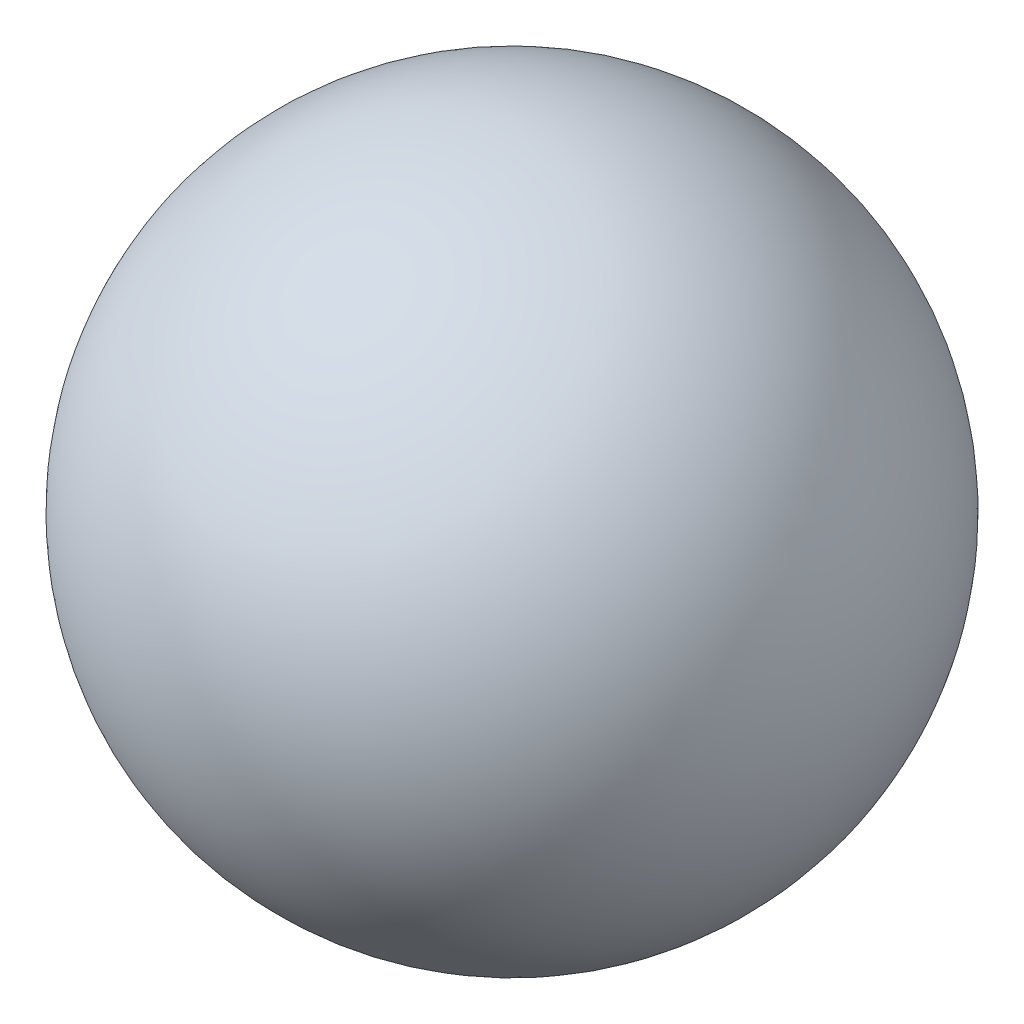
from build123d import *

# Parameters (mm, degrees)
SKETCH1_W           = 200
SKETCH1_H           = 200
BOSS_EXTRUDE1_DEPTH = 850
SKETCH2_R           = 3
CUT_EXTRUDE1_DEPTH  = 10


with BuildPart() as part:
    # Sketch1 → Boss-Extrude1 (new body)
    with BuildSketch(Plane(origin=(0, 0, 0), x_dir=(1, 0, 0), z_dir=(0, 1, 0))):
        with Locations((100, 100)):
            Rectangle(SKETCH1_W, SKETCH1_H)
    extrude(amount=BOSS_EXTRUDE1_DEPTH)

    # Sketch2 → Cut-Extrude1 (cut)
    with BuildSketch(Plane(origin=(0, 850, 0), x_dir=(1, 0, 0), z_dir=(0, 1, 0))):
        with Locations(Location((100, 161.5, 0), (0, 0, 270))):
            Circle(SKETCH2_R)
        with Locations(Location((161.5, 100, 0), (0, 0, 270))):
            Circle(SKETCH2_R)
        with Locations(Location((100, 38.5, 0), (0, 0, 270))):
            Circle(SKETCH2_R)
        with Locations(Location((38.5, 100, 0), (0, 0, 270))):
            Circle(SKETCH2_R)
    extrude(amount=-CUT_EXTRUDE1_DEPTH, mode=Mode.SUBTRACT)


with BuildPart() as body_2:
    # Sketch3 → Revolve1 (revolve)
    with BuildSketch(Plane(origin=(0, 850, 0), x_dir=(1, 0, 0), z_dir=(0, 1, 0))):
        with BuildLine():
            Line((-1713, 100), (1913, 100))
            ThreePointArc((1913, 100), (100, -1713), (-1713, 100))
        make_face()
    revolve(axis=Axis((-1713, 850, -100), (1, 0, 0)))


solid = Compound([part.part, body_2.part])
